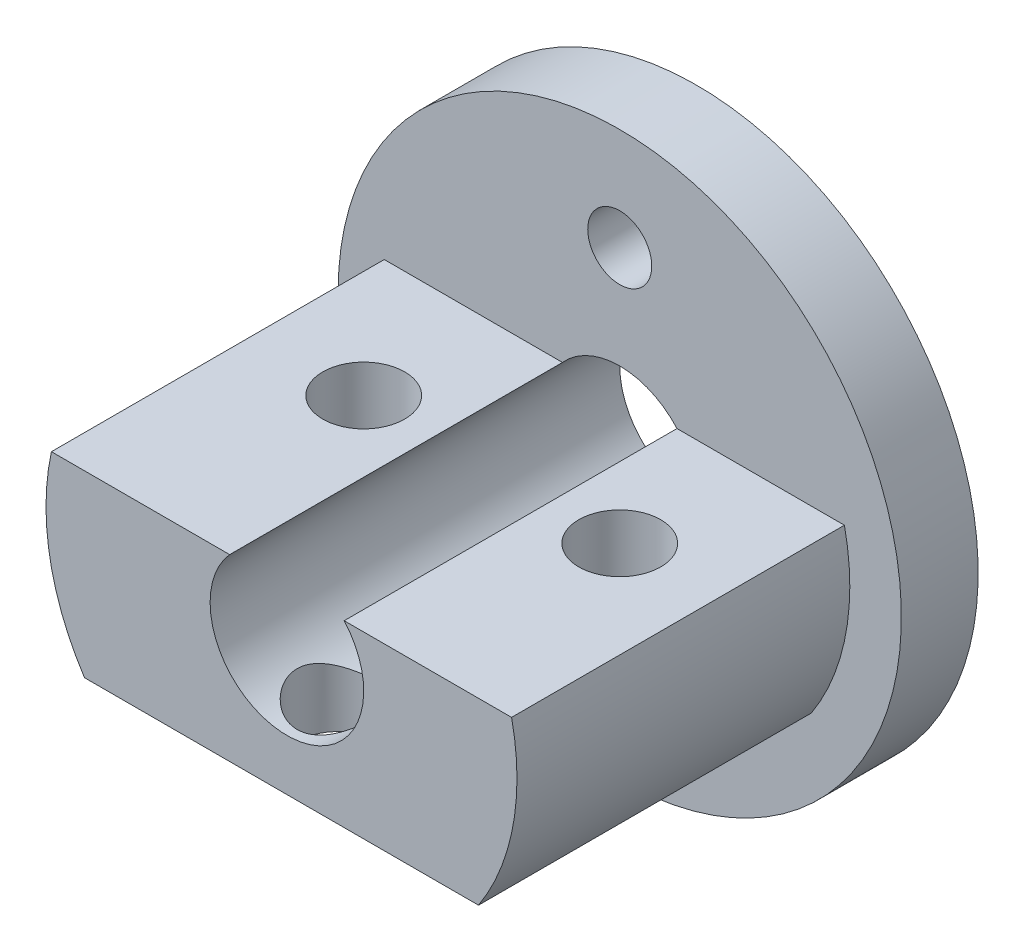
from build123d import *

# Parameters (mm, degrees)
SKETCH_1_W                  = 11
SKETCH_1_H                  = 3
EXTRUDE_1_DEPTH             = 13
HOLE_WIZARD_2_5_2_5_1_D     = 2.5
HOLE_WIZARD_2_5_2_5_1_DEPTH = 16
HOLE_WIZARD_3_2_3_2_1_D     = 3.2
HOLE_WIZARD_3_2_3_2_1_DEPTH = 16
HOLE_WIZARD_6_0_6_1_D       = 6
HOLE_WIZARD_3_2_3_2_2_D     = 3.2
HOLE_WIZARD_3_2_3_2_2_DEPTH = 16


with BuildPart() as part:
    # 草图1 → 旋转1 (revolve)
    with BuildSketch(Plane.XZ, mode=Mode.PRIVATE) as revolve_1_sk:
        with Locations((5.5, 1.5)):
            Rectangle(SKETCH_1_W, SKETCH_1_H)
    revolve(revolve_1_sk.sketch.rotate(Axis((0, 0, 3), (0, 0, -1)), 180), axis=Axis((0, 0, 3), (0, 0, -1)))

    # 草图2 → 凸台-拉伸1 (add)
    with BuildSketch(Plane.XY.offset(3)):
        with BuildLine():
            Line((7.483314774, -5), (-7.907139717, -5))
            ThreePointArc((-7.907139717, -5), (-9.257527395, -1.630006909), (-9.198789331, 2))
            Line((-9.198789331, 2), (8.774964387, 2))
            ThreePointArc((8.774964387, 2), (8.833702451, -1.630006909), (7.483314774, -5))
        make_face()
    extrude(amount=EXTRUDE_1_DEPTH)

    # Ø2.5 (2.5) 直径孔1
    with Locations(Plane(origin=(0, 0, 0), x_dir=(-1, 0, 0), z_dir=(0, 0, -1))):
        with Locations((0, -7), (0, 7)):
            Hole(HOLE_WIZARD_2_5_2_5_1_D / 2, depth=HOLE_WIZARD_2_5_2_5_1_DEPTH)

    # Ø3.2 (3.2) 直径孔1
    with Locations(Plane(origin=(0, -5, 0), x_dir=(-1, 0, 0), z_dir=(0, -1, 0))):
        with Locations((5, -8), (-5, -8)):
            Hole(HOLE_WIZARD_3_2_3_2_1_D / 2, depth=HOLE_WIZARD_3_2_3_2_1_DEPTH)

    # Ø6.0 (6) 直径孔1 (through all)
    with Locations(Plane(origin=(0, 0, 0), x_dir=(-1, 0, 0), z_dir=(0, 0, -1))):
        with Locations((0, 0)):
            Hole(HOLE_WIZARD_6_0_6_1_D / 2)

    # Ø3.2 (3.2) 直径孔2
    with Locations(Plane(origin=(0, -5, 0), x_dir=(-1, 0, 0), z_dir=(0, -1, 0))):
        with Locations((0, -14)):
            Hole(HOLE_WIZARD_3_2_3_2_2_D / 2, depth=HOLE_WIZARD_3_2_3_2_2_DEPTH)


solid = part.part
